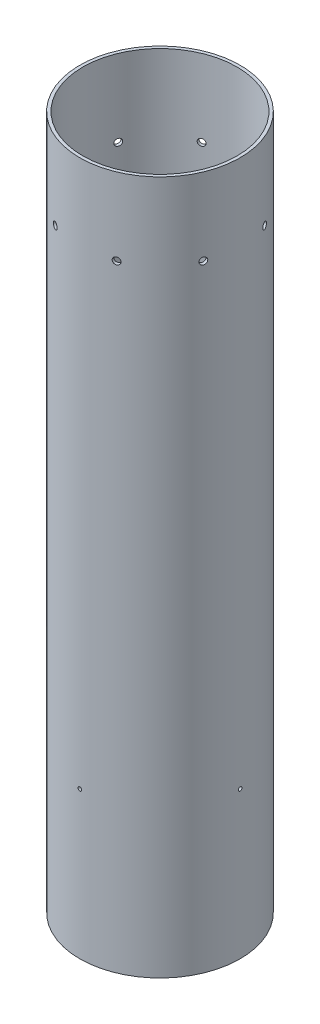
from build123d import *

# Parameters (mm, degrees)
SKETCH1_R           = 52.832
SKETCH1_R_2         = 50.8
BOSS_EXTRUDE1_DEPTH = 457.2
CIRPATTERN1_COUNT   = 4
CIRPATTERN2_COUNT   = 8


with BuildPart() as part:
    # Sketch1 → Boss-Extrude1 (new body)
    with BuildSketch(Plane(origin=(0, 0, 0), x_dir=(1, 0, 0), z_dir=(0, 1, 0))):
        with Locations(Location((0, 0, 0), (0, 0, 270))):
            Circle(SKETCH1_R)
        with Locations(Location((0, 0, 0), (0, 0, 270))):
            Circle(SKETCH1_R_2, mode=Mode.SUBTRACT)
    extrude(amount=BOSS_EXTRUDE1_DEPTH)

    # Sketch4 → #2 Clearance Hole1 (revolve, cut)
    with BuildSketch(Plane(origin=(0, 96.9772, 52.832), x_dir=(0, -1, 0), z_dir=(1, 0, 0))):
        Polygon((0, 0), (0, 55.596569267), (1.2192, 54.864), (1.2192, 0), align=None)
    f_2_clearance_hole1 = revolve(axis=Axis((0, 96.9772, 59.182), (0, 0, -1)), mode=Mode.SUBTRACT)

    # Sketch6 → #8 Clearance Hole1 (revolve, cut)
    with BuildSketch(Plane(origin=(20.217931099, 406.4, 48.810403462), x_dir=(0.9238795325112864, 0, -0.38268343236509056), z_dir=(0, 1, 0))):
        Polygon((0, 0), (0, 56.214674586), (2.2479, 54.864), (2.2479, 0), align=None)
    f_8_clearance_hole1 = revolve(axis=Axis((22.647970894, 406.4, 54.677038493), (-0.38268343236509056, 0, -0.9238795325112865)), mode=Mode.SUBTRACT)

    # CirPattern1: #2 Clearance Hole1 ×4 about axis
    cirpattern1_axis = Axis((0, 457.2, 0), (0, -1, 0))
    for i in range(1, CIRPATTERN1_COUNT):
        add(f_2_clearance_hole1.rotate(cirpattern1_axis, i * 360 / CIRPATTERN1_COUNT), mode=Mode.SUBTRACT)

    # CirPattern2: #8 Clearance Hole1 ×8 about axis
    cirpattern2_axis = Axis((0, 457.2, 0), (0, -1, 0))
    for i in range(1, CIRPATTERN2_COUNT):
        add(f_8_clearance_hole1.rotate(cirpattern2_axis, i * 360 / CIRPATTERN2_COUNT), mode=Mode.SUBTRACT)


solid = part.part
